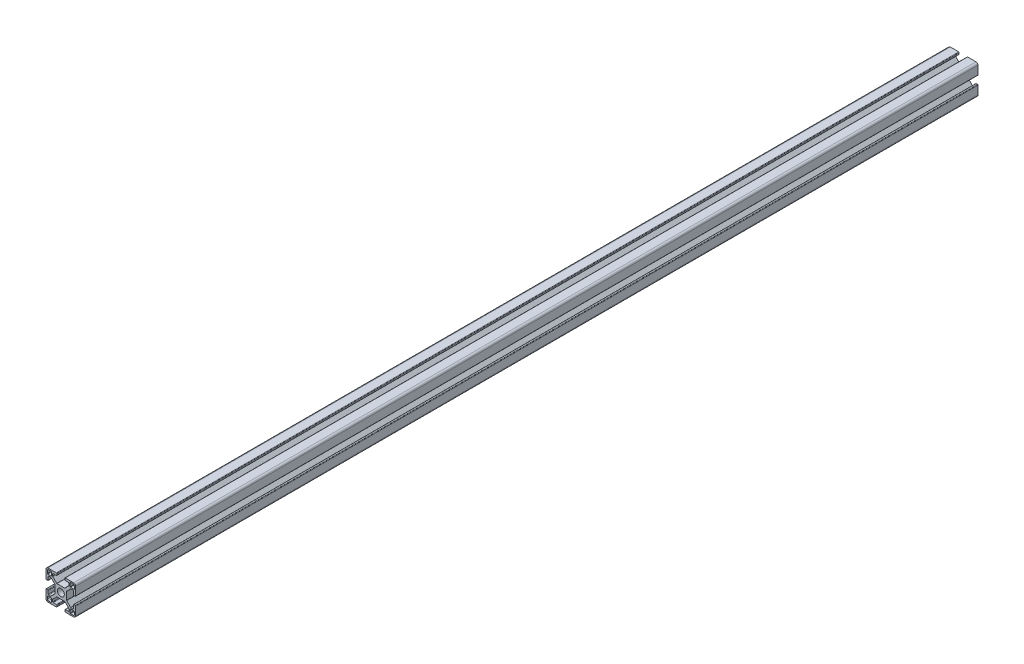
from build123d import *

# Parameters (mm, degrees)
SKETCH1_R           = 3.52998588
BOSS_EXTRUDE1_DEPTH = 457.2


with BuildPart() as part:
    # Sketch1 → Boss-Extrude1 (new, symmetric)
    with BuildSketch(Plane.XY):
        with BuildLine():
            Line((14.49994, -4), (13.24247465, -4))
            ThreePointArc((13.24247465, -4), (12.88892126, -4.146446609), (12.74247465, -4.5))
            Line((12.74247465, -4.5), (12.74247465, -7.732519321))
            ThreePointArc((12.74247465, -7.732519321), (12.602449697, -8.097296796), (12.242781236, -8.249967))
            Line((12.242781236, -8.249967), (10.260188032, -8.249967))
            ThreePointArc((10.260188032, -8.249967), (10.068847082, -8.211906919), (9.906636056, -8.103520976))
            Line((9.906636056, -8.103520976), (5.981117769, -4.178002689))
            ThreePointArc((5.981117769, -4.178002689), (5.872731827, -4.015791664), (5.834671745, -3.824450713))
            Line((5.834671745, -3.824450713), (5.834671745, -1.01249595))
            Line((5.834671745, -1.01249595), (5.834671745, 0.88749645))
            Line((5.834671745, 0.88749645), (5.834671745, 3.824450713))
            ThreePointArc((5.834671745, 3.824450713), (5.872731827, 4.015791664), (5.981117769, 4.178002689))
            Line((5.981117769, 4.178002689), (9.906636056, 8.103520976))
            ThreePointArc((9.906636056, 8.103520976), (10.068847082, 8.211906919), (10.260188032, 8.249967))
            Line((10.260188032, 8.249967), (12.242781236, 8.249967))
            ThreePointArc((12.242781236, 8.249967), (12.602449697, 8.097296796), (12.74247465, 7.732519321))
            Line((12.74247465, 7.732519321), (12.74247465, 4.5))
            ThreePointArc((12.74247465, 4.5), (12.88892126, 4.146446609), (13.24247465, 4))
            Line((13.24247465, 4), (14.49994, 4))
            ThreePointArc((14.49994, 4), (14.853493391, 4.146446609), (14.99994, 4.5))
            Line((14.99994, 4.5), (14.99994, 12.999948))
            ThreePointArc((14.99994, 12.999948), (14.414155906, 14.414155906), (12.999948, 14.99994))
            Line((12.999948, 14.99994), (4.5, 14.99994))
            ThreePointArc((4.5, 14.99994), (4.146446609, 14.853493391), (4, 14.49994))
            Line((4, 14.49994), (4, 13.24247465))
            ThreePointArc((4, 13.24247465), (4.146446609, 12.88892126), (4.5, 12.74247465))
            Line((4.5, 12.74247465), (7.732519321, 12.74247465))
            ThreePointArc((7.732519321, 12.74247465), (8.097296796, 12.602449697), (8.249967, 12.242781236))
            Line((8.249967, 12.242781236), (8.249967, 10.260188032))
            ThreePointArc((8.249967, 10.260188032), (8.211906919, 10.068847082), (8.103520976, 9.906636056))
            Line((8.103520976, 9.906636056), (4.178002689, 5.981117769))
            ThreePointArc((4.178002689, 5.981117769), (4.015791664, 5.872731827), (3.824450713, 5.834671745))
            Line((3.824450713, 5.834671745), (0.9499962, 5.834671745))
            Line((0.9499962, 5.834671745), (-0.9499962, 5.834671745))
            Line((-0.9499962, 5.834671745), (-3.824450713, 5.834671745))
            ThreePointArc((-3.824450713, 5.834671745), (-4.015791664, 5.872731827), (-4.178002689, 5.981117769))
            Line((-4.178002689, 5.981117769), (-8.103520976, 9.906636056))
            ThreePointArc((-8.103520976, 9.906636056), (-8.211906919, 10.068847082), (-8.249967, 10.260188032))
            Line((-8.249967, 10.260188032), (-8.249967, 12.242781236))
            ThreePointArc((-8.249967, 12.242781236), (-8.097296796, 12.602449697), (-7.732519321, 12.74247465))
            Line((-7.732519321, 12.74247465), (-4.5, 12.74247465))
            ThreePointArc((-4.5, 12.74247465), (-4.146446609, 12.88892126), (-4, 13.24247465))
            Line((-4, 13.24247465), (-4, 14.49994))
            ThreePointArc((-4, 14.49994), (-4.146446609, 14.853493391), (-4.5, 14.99994))
            Line((-4.5, 14.99994), (-12.999948, 14.99994))
            ThreePointArc((-12.999948, 14.99994), (-14.414155906, 14.414155906), (-14.99994, 12.999948))
            Line((-14.99994, 12.999948), (-14.99994, 4.5))
            ThreePointArc((-14.99994, 4.5), (-14.853493391, 4.146446609), (-14.49994, 4))
            Line((-14.49994, 4), (-13.24247465, 4))
            ThreePointArc((-13.24247465, 4), (-12.88892126, 4.146446609), (-12.74247465, 4.5))
            Line((-12.74247465, 4.5), (-12.74247465, 7.732519321))
            ThreePointArc((-12.74247465, 7.732519321), (-12.602449697, 8.097296796), (-12.242781236, 8.249967))
            Line((-12.242781236, 8.249967), (-10.260188032, 8.249967))
            ThreePointArc((-10.260188032, 8.249967), (-10.068847082, 8.211906919), (-9.906636056, 8.103520976))
            Line((-9.906636056, 8.103520976), (-5.981117769, 4.178002689))
            ThreePointArc((-5.981117769, 4.178002689), (-5.872731827, 4.015791664), (-5.834671745, 3.824450713))
            Line((-5.834671745, 3.824450713), (-5.834671745, 0.88749645))
            Line((-5.834671745, 0.88749645), (-5.834671745, -1.01249595))
            Line((-5.834671745, -1.01249595), (-5.834671745, -3.824450713))
            ThreePointArc((-5.834671745, -3.824450713), (-5.872731827, -4.015791664), (-5.981117769, -4.178002689))
            Line((-5.981117769, -4.178002689), (-9.906636056, -8.103520976))
            ThreePointArc((-9.906636056, -8.103520976), (-10.068847082, -8.211906919), (-10.260188032, -8.249967))
            Line((-10.260188032, -8.249967), (-12.242781236, -8.249967))
            ThreePointArc((-12.242781236, -8.249967), (-12.602449697, -8.097296796), (-12.74247465, -7.732519321))
            Line((-12.74247465, -7.732519321), (-12.74247465, -4.5))
            ThreePointArc((-12.74247465, -4.5), (-12.88892126, -4.146446609), (-13.24247465, -4))
            Line((-13.24247465, -4), (-14.49994, -4))
            ThreePointArc((-14.49994, -4), (-14.853493391, -4.146446609), (-14.99994, -4.5))
            Line((-14.99994, -4.5), (-14.99994, -12.999948))
            ThreePointArc((-14.99994, -12.999948), (-14.414155906, -14.414155906), (-12.999948, -14.99994))
            Line((-12.999948, -14.99994), (-4.5, -14.99994))
            ThreePointArc((-4.5, -14.99994), (-4.146446609, -14.853493391), (-4, -14.49994))
            Line((-4, -14.49994), (-4, -13.24247465))
            ThreePointArc((-4, -13.24247465), (-4.146446609, -12.88892126), (-4.5, -12.74247465))
            Line((-4.5, -12.74247465), (-7.732519321, -12.74247465))
            ThreePointArc((-7.732519321, -12.74247465), (-8.097296796, -12.602449697), (-8.249967, -12.242781236))
            Line((-8.249967, -12.242781236), (-8.249967, -10.260188032))
            ThreePointArc((-8.249967, -10.260188032), (-8.211906919, -10.068847082), (-8.103520976, -9.906636056))
            Line((-8.103520976, -9.906636056), (-4.178002689, -5.981117769))
            ThreePointArc((-4.178002689, -5.981117769), (-4.015791664, -5.872731827), (-3.824450713, -5.834671745))
            Line((-3.824450713, -5.834671745), (-0.9499962, -5.834671745))
            Line((-0.9499962, -5.834671745), (0.9499962, -5.834671745))
            Line((0.9499962, -5.834671745), (3.824450713, -5.834671745))
            ThreePointArc((3.824450713, -5.834671745), (4.015791664, -5.872731827), (4.178002689, -5.981117769))
            Line((4.178002689, -5.981117769), (8.103520976, -9.906636056))
            ThreePointArc((8.103520976, -9.906636056), (8.211906919, -10.068847082), (8.249967, -10.260188032))
            Line((8.249967, -10.260188032), (8.249967, -12.242781236))
            ThreePointArc((8.249967, -12.242781236), (8.097296796, -12.602449697), (7.732519321, -12.74247465))
            Line((7.732519321, -12.74247465), (4.5, -12.74247465))
            ThreePointArc((4.5, -12.74247465), (4.146446609, -12.88892126), (4, -13.24247465))
            Line((4, -13.24247465), (4, -14.49994))
            ThreePointArc((4, -14.49994), (4.146446609, -14.853493391), (4.5, -14.99994))
            Line((4.5, -14.99994), (12.999948, -14.99994))
            ThreePointArc((12.999948, -14.99994), (14.414155906, -14.414155906), (14.99994, -12.999948))
            Line((14.99994, -12.999948), (14.99994, -4.5))
            ThreePointArc((14.99994, -4.5), (14.853493391, -4.146446609), (14.49994, -4))
        make_face()
        Circle(SKETCH1_R, mode=Mode.SUBTRACT)
        with BuildLine():
            Line((-12.6999492, -13.6999452), (-9.880960476, -13.6999452))
            ThreePointArc((-9.880960476, -13.6999452), (-9.61155387, -13.58835333), (-9.499962, -13.318946724))
            Line((-9.499962, -13.318946724), (-9.499962, -9.87996048))
            ThreePointArc((-9.499962, -9.87996048), (-9.611260978, -9.611260978), (-9.87996048, -9.499962))
            Line((-9.87996048, -9.499962), (-13.318946724, -9.499962))
            ThreePointArc((-13.318946724, -9.499962), (-13.58835333, -9.61155387), (-13.6999452, -9.880960476))
            Line((-13.6999452, -9.880960476), (-13.6999452, -12.6999492))
            ThreePointArc((-13.6999452, -12.6999492), (-13.407053153, -13.407053153), (-12.6999492, -13.6999452))
        make_face(mode=Mode.SUBTRACT)
        with BuildLine():
            Line((13.6999452, -12.6999492), (13.6999452, -9.880960476))
            ThreePointArc((13.6999452, -9.880960476), (13.58835333, -9.61155387), (13.318946724, -9.499962))
            Line((13.318946724, -9.499962), (9.87996048, -9.499962))
            ThreePointArc((9.87996048, -9.499962), (9.611260978, -9.611260978), (9.499962, -9.87996048))
            Line((9.499962, -9.87996048), (9.499962, -13.318946724))
            ThreePointArc((9.499962, -13.318946724), (9.61155387, -13.58835333), (9.880960476, -13.6999452))
            Line((9.880960476, -13.6999452), (12.6999492, -13.6999452))
            ThreePointArc((12.6999492, -13.6999452), (13.407053153, -13.407053153), (13.6999452, -12.6999492))
        make_face(mode=Mode.SUBTRACT)
        with BuildLine():
            Line((9.87996048, 9.499962), (13.318946724, 9.499962))
            ThreePointArc((13.318946724, 9.499962), (13.58835333, 9.61155387), (13.6999452, 9.880960476))
            Line((13.6999452, 9.880960476), (13.6999452, 12.6999492))
            ThreePointArc((13.6999452, 12.6999492), (13.407053153, 13.407053153), (12.6999492, 13.6999452))
            Line((12.6999492, 13.6999452), (9.880960476, 13.6999452))
            ThreePointArc((9.880960476, 13.6999452), (9.61155387, 13.58835333), (9.499962, 13.318946724))
            Line((9.499962, 13.318946724), (9.499962, 9.87996048))
            ThreePointArc((9.499962, 9.87996048), (9.611260978, 9.611260978), (9.87996048, 9.499962))
        make_face(mode=Mode.SUBTRACT)
        with BuildLine():
            Line((-13.6999452, 12.6999492), (-13.6999452, 9.880960476))
            ThreePointArc((-13.6999452, 9.880960476), (-13.58835333, 9.61155387), (-13.318946724, 9.499962))
            Line((-13.318946724, 9.499962), (-9.87996048, 9.499962))
            ThreePointArc((-9.87996048, 9.499962), (-9.611260978, 9.611260978), (-9.499962, 9.87996048))
            Line((-9.499962, 9.87996048), (-9.499962, 13.318946724))
            ThreePointArc((-9.499962, 13.318946724), (-9.61155387, 13.58835333), (-9.880960476, 13.6999452))
            Line((-9.880960476, 13.6999452), (-12.6999492, 13.6999452))
            ThreePointArc((-12.6999492, 13.6999452), (-13.407053153, 13.407053153), (-13.6999452, 12.6999492))
        make_face(mode=Mode.SUBTRACT)
    extrude(amount=BOSS_EXTRUDE1_DEPTH, both=True)


solid = part.part
